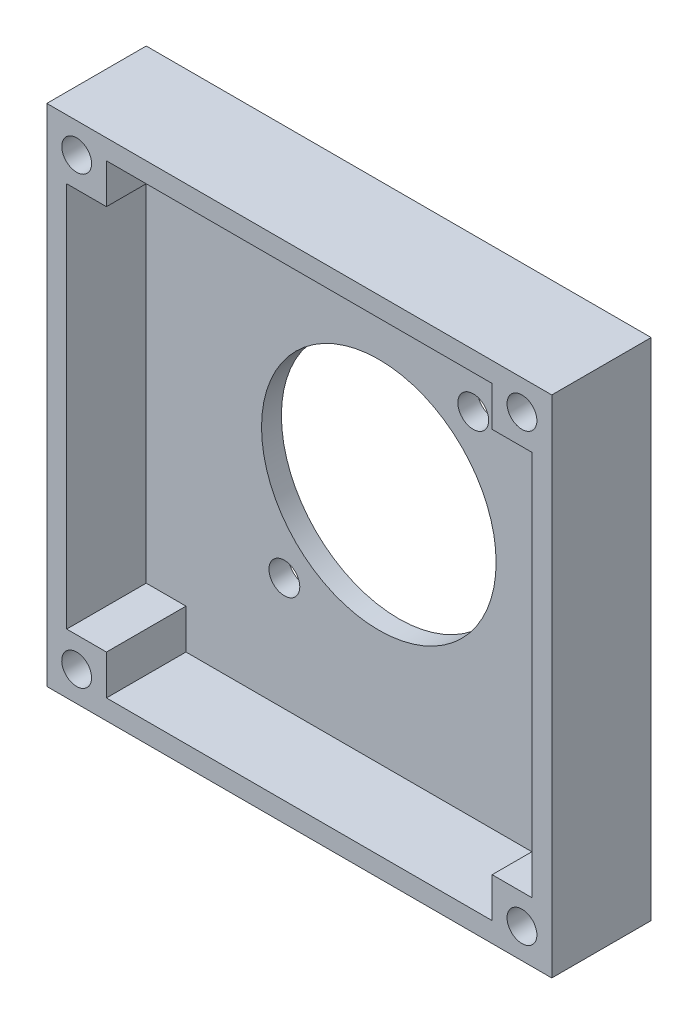
from build123d import *
from build123d.topology import SkipClean

# Parameters (mm, degrees)
SKETCH3_W           = 50.8
SKETCH3_H           = 50.8
SKETCH3_R           = 11.8
SKETCH3_R_2         = 1.55
BOSS_EXTRUDE5_DEPTH = 2
SKETCH1_W           = 2
SKETCH1_H           = 38.8
SKETCH1_W_2         = 38.8
SKETCH1_H_2         = 2
BOSS_EXTRUDE6_DEPTH = 10
SKETCH7_R           = 1.5
CUT_EXTRUDE2_DEPTH  = 37.80108694


with BuildPart() as part:
    # Sketch3 → Boss-Extrude5 (new body)
    with BuildSketch(Plane.XY):
        Rectangle(SKETCH3_W, SKETCH3_H)
        Circle(SKETCH3_R, mode=Mode.SUBTRACT)
        with Locations((-9.5, -12)):
            Circle(SKETCH3_R_2, mode=Mode.SUBTRACT)
        with Locations((9.5, 12)):
            Circle(SKETCH3_R_2, mode=Mode.SUBTRACT)
    extrude(amount=BOSS_EXTRUDE5_DEPTH)

    # Sketch1 → Boss-Extrude6 (add)
    with BuildSketch(Plane.XY):
        with Locations((24.4, 0)):
            Rectangle(SKETCH1_W, SKETCH1_H)
        with BuildLine():
            Line((21.281966011, -23.4), (19.4, -23.4))
            Line((19.4, -23.4), (19.4, -25.4))
            Line((19.4, -25.4), (25.4, -25.4))
            Line((25.4, -25.4), (25.4, -19.4))
            Line((25.4, -19.4), (23.4, -19.4))
            Line((23.4, -19.4), (23.4, -21.281966011))
            ThreePointArc((23.4, -21.281966011), (23.769306394, -21.787627564), (23.9, -22.4))
            ThreePointArc((23.9, -22.4), (22.935233135, -23.801258538), (21.281966011, -23.4))
        make_face()
        with BuildLine():
            Line((19.4, -19.4), (19.4, -23.4))
            Line((19.4, -23.4), (21.281966011, -23.4))
            ThreePointArc((21.281966011, -23.4), (21.339339828, -21.339339828), (23.4, -21.281966011))
            Line((23.4, -21.281966011), (23.4, -19.4))
            Line((23.4, -19.4), (19.4, -19.4))
        make_face()
        with Locations((0, -24.4)):
            Rectangle(SKETCH1_W_2, SKETCH1_H_2)
        with BuildLine():
            ThreePointArc((-20.9, -22.4), (-20.998741462, -22.935233135), (-21.281966011, -23.4))
            Line((-21.281966011, -23.4), (-19.4, -23.4))
            Line((-19.4, -23.4), (-19.4, -19.4))
            Line((-19.4, -19.4), (-23.4, -19.4))
            Line((-23.4, -19.4), (-23.4, -21.281966011))
            ThreePointArc((-23.4, -21.281966011), (-21.787627564, -21.030693606), (-20.9, -22.4))
        make_face()
        with BuildLine():
            Line((-19.4, -23.4), (-21.281966011, -23.4))
            ThreePointArc((-21.281966011, -23.4), (-23.460660172, -23.460660172), (-23.4, -21.281966011))
            Line((-23.4, -21.281966011), (-23.4, -19.4))
            Line((-23.4, -19.4), (-25.4, -19.4))
            Line((-25.4, -19.4), (-25.4, -25.4))
            Line((-25.4, -25.4), (-19.4, -25.4))
            Line((-19.4, -25.4), (-19.4, -23.4))
        make_face()
        with Locations((-24.4, 0)):
            Rectangle(SKETCH1_W, SKETCH1_H)
        with BuildLine():
            Line((-25.4, 19.4), (-23.4, 19.4))
            Line((-23.4, 19.4), (-23.4, 21.281966011))
            ThreePointArc((-23.4, 21.281966011), (-23.460660172, 23.460660172), (-21.281966011, 23.4))
            Line((-21.281966011, 23.4), (-19.4, 23.4))
            Line((-19.4, 23.4), (-19.4, 25.4))
            Line((-19.4, 25.4), (-25.4, 25.4))
            Line((-25.4, 25.4), (-25.4, 19.4))
        make_face()
        with BuildLine():
            Line((-23.4, 21.281966011), (-23.4, 19.4))
            Line((-23.4, 19.4), (-19.4, 19.4))
            Line((-19.4, 19.4), (-19.4, 23.4))
            Line((-19.4, 23.4), (-21.281966011, 23.4))
            ThreePointArc((-21.281966011, 23.4), (-20.998741462, 22.935233135), (-20.9, 22.4))
            ThreePointArc((-20.9, 22.4), (-21.787627564, 21.030693606), (-23.4, 21.281966011))
        make_face()
        with Locations((0, 24.4)):
            Rectangle(SKETCH1_W_2, SKETCH1_H_2)
        with BuildLine():
            Line((23.4, 21.281966011), (23.4, 19.4))
            Line((23.4, 19.4), (25.4, 19.4))
            Line((25.4, 19.4), (25.4, 25.4))
            Line((25.4, 25.4), (19.4, 25.4))
            Line((19.4, 25.4), (19.4, 23.4))
            Line((19.4, 23.4), (21.281966011, 23.4))
            ThreePointArc((21.281966011, 23.4), (22.935233135, 23.801258538), (23.9, 22.4))
            ThreePointArc((23.9, 22.4), (23.769306394, 21.787627564), (23.4, 21.281966011))
        make_face()
        with BuildLine():
            Line((19.4, 19.4), (23.4, 19.4))
            Line((23.4, 19.4), (23.4, 21.281966011))
            ThreePointArc((23.4, 21.281966011), (21.339339828, 21.339339828), (21.281966011, 23.4))
            Line((21.281966011, 23.4), (19.4, 23.4))
            Line((19.4, 23.4), (19.4, 19.4))
        make_face()
    extrude(amount=BOSS_EXTRUDE6_DEPTH)

    # Sketch7 → Cut-Extrude2 (cut, through all)
    with SkipClean():  # the faces are left unmerged after this step: merging them gives an invalid solid
        with BuildSketch(Plane.XY.offset(2)):
            with Locations((-22.4, 22.4)):
                Circle(SKETCH7_R)
            with Locations(Location((22.4, 22.4, 0), (0, 0, 180))):
                Circle(SKETCH7_R)
            with Locations((22.4, -22.529256464)):
                Circle(SKETCH7_R)
            with Locations(Location((-22.4, -22.529256464, 0), (0, 0, 2.46938104))):
                Circle(SKETCH7_R)
        extrude(amount=-CUT_EXTRUDE2_DEPTH, mode=Mode.SUBTRACT)


solid = part.part
